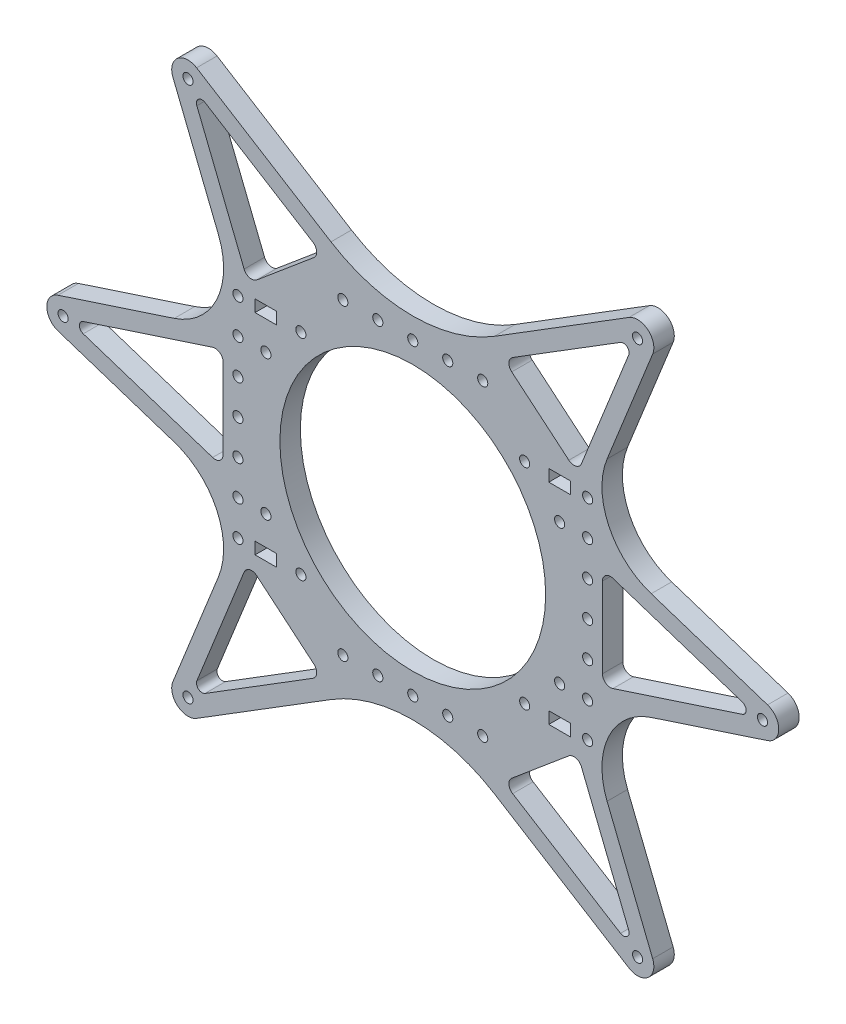
from build123d import *

# Parameters (mm, degrees)
SKETCH1_R           = 1.450000006
SKETCH1_R_2         = 1.45
SKETCH1_R_3         = 38
SKETCH1_W           = 6.2
SKETCH1_H           = 3.4
BOSS_EXTRUDE1_DEPTH = 5.85


with BuildPart() as part:
    # Sketch1 → Boss-Extrude1 (new body)
    with BuildSketch(Plane.XY):
        with BuildLine():
            Line((587.995290395, 497.753361998), (601.026388312, 465.269666287))
            ThreePointArc((601.026388312, 465.269666287), (600.580353033, 449.003385667), (588.406365105, 438.205939183))
            Line((588.406365105, 438.205939183), (555.146182231, 427.30822221))
            ThreePointArc((555.146182231, 427.30822221), (551.939243509, 422.882775531), (555.146182231, 418.457328853))
            Line((555.146182231, 418.457328853), (588.406366938, 407.55961128))
            ThreePointArc((588.406366938, 407.55961128), (600.58035448, 396.762164902), (601.026389221, 380.495884628))
            Line((601.026389221, 380.495884628), (587.995289899, 348.01218948))
            ThreePointArc((587.995289899, 348.01218948), (589.32399836, 342.710908714), (594.775468563, 342.322944064))
            Line((594.775468563, 342.322944064), (633.210915705, 366.208380082))
            ThreePointArc((633.210915705, 366.208380082), (644.436635852, 371.181514399), (656.596182238, 372.882775531))
            ThreePointArc((656.596182238, 372.882775531), (668.755728624, 371.181514399), (679.981448771, 366.208380082))
            Line((679.981448771, 366.208380082), (718.416895913, 342.322944064))
            ThreePointArc((718.416895913, 342.322944064), (723.868366115, 342.710908714), (725.197074576, 348.01218948))
            Line((725.197074576, 348.01218948), (712.165975255, 380.495884628))
            ThreePointArc((712.165975255, 380.495884628), (712.612009996, 396.762164902), (724.785997538, 407.559611279))
            Line((724.785997538, 407.559611279), (758.046182244, 418.457328853))
            ThreePointArc((758.046182244, 418.457328853), (761.253120966, 422.882775531), (758.046182244, 427.30822221))
            Line((758.046182244, 427.30822221), (724.785999371, 438.205939183))
            ThreePointArc((724.785999371, 438.205939183), (712.612011443, 449.003385667), (712.165976164, 465.269666287))
            Line((712.165976164, 465.269666287), (725.197074081, 497.753361998))
            ThreePointArc((725.197074081, 497.753361998), (723.86836572, 503.054641878), (718.416896408, 503.442606583))
            Line((718.416896408, 503.442606583), (679.981448771, 479.557172561))
            ThreePointArc((679.981448771, 479.557172561), (668.755728555, 474.584038083), (656.596182238, 472.882775531))
            ThreePointArc((656.596182238, 472.882775531), (644.436635921, 474.584038083), (633.210915705, 479.557172561))
            Line((633.210915705, 479.557172561), (594.775468067, 503.442606583))
            ThreePointArc((594.775468067, 503.442606583), (589.323998755, 503.054641878), (587.995290395, 497.753361998))
        make_face()
        with Locations((592.317421269, 499.487219843)):
            Circle(SKETCH1_R, mode=Mode.SUBTRACT)
        with Locations(Location((706.596182238, 432.882775531, 0), (0, 0, 180))):
            Circle(SKETCH1_R_2, mode=Mode.SUBTRACT)
        with Locations(Location((706.596182238, 442.882775531, 0), (0, 0, 180))):
            Circle(SKETCH1_R_2, mode=Mode.SUBTRACT)
        with Locations(Location((706.596182238, 452.882775531, 0), (0, 0, 180))):
            Circle(SKETCH1_R_2, mode=Mode.SUBTRACT)
        with Locations((706.596182238, 392.882775531)):
            Circle(SKETCH1_R_2, mode=Mode.SUBTRACT)
        with Locations((556.596182238, 422.882775531)):
            Circle(SKETCH1_R, mode=Mode.SUBTRACT)
        with Locations(Location((646.596182238, 378.882775531, 0), (0, 0, 180))):
            Circle(SKETCH1_R_2, mode=Mode.SUBTRACT)
        with Locations((656.596182238, 422.882775531)):
            Circle(SKETCH1_R_3, mode=Mode.SUBTRACT)
        with Locations(Location((636.596182238, 378.882775531, 0), (0, 0, 180))):
            Circle(SKETCH1_R_2, mode=Mode.SUBTRACT)
        with Locations((706.596182238, 402.882775531)):
            Circle(SKETCH1_R_2, mode=Mode.SUBTRACT)
        with Locations((656.596182238, 466.882775531)):
            Circle(SKETCH1_R_2, mode=Mode.SUBTRACT)
        with Locations((592.317421269, 346.278331219)):
            Circle(SKETCH1_R, mode=Mode.SUBTRACT)
        with Locations((706.596182238, 412.882775531)):
            Circle(SKETCH1_R_2, mode=Mode.SUBTRACT)
        with Locations(Location((656.596182238, 378.882775531, 0), (0, 0, 180))):
            Circle(SKETCH1_R_2, mode=Mode.SUBTRACT)
        with Locations(Location((698.596182238, 442.882775531, 0), (0, 0, 180))):
            Circle(SKETCH1_R_2, mode=Mode.SUBTRACT)
        with Locations((698.596182238, 402.882775531)):
            Circle(SKETCH1_R_2, mode=Mode.SUBTRACT)
        with Locations((646.596182238, 466.882775531)):
            Circle(SKETCH1_R_2, mode=Mode.SUBTRACT)
        with Locations((636.596182238, 466.882775531)):
            Circle(SKETCH1_R_2, mode=Mode.SUBTRACT)
        with Locations(Location((676.596182238, 466.882775531, 0), (0, 0, 180))):
            Circle(SKETCH1_R_2, mode=Mode.SUBTRACT)
        with Locations(Location((666.596182238, 466.882775531, 0), (0, 0, 180))):
            Circle(SKETCH1_R_2, mode=Mode.SUBTRACT)
        with Locations(Location((706.596182238, 422.882775531, 0), (0, 0, 180))):
            Circle(SKETCH1_R_2, mode=Mode.SUBTRACT)
        with Locations(Location((688.596182238, 452.882775531, 0), (0, 0, 180))):
            Circle(SKETCH1_R_2, mode=Mode.SUBTRACT)
        with Locations((688.596182238, 392.882775531)):
            Circle(SKETCH1_R_2, mode=Mode.SUBTRACT)
        with Locations(Location((624.596182238, 392.882775531, 0), (0, 0, 180))):
            Circle(SKETCH1_R_2, mode=Mode.SUBTRACT)
        with Locations(Location((720.874943207, 346.278331219, 0), (0, 0, 180))):
            Circle(SKETCH1_R, mode=Mode.SUBTRACT)
        with Locations((676.596182238, 378.882775531)):
            Circle(SKETCH1_R_2, mode=Mode.SUBTRACT)
        with Locations((666.596182238, 378.882775531)):
            Circle(SKETCH1_R_2, mode=Mode.SUBTRACT)
        with Locations(Location((756.596182238, 422.882775531, 0), (0, 0, 180))):
            Circle(SKETCH1_R, mode=Mode.SUBTRACT)
        with Locations((624.596182238, 452.882775531)):
            Circle(SKETCH1_R_2, mode=Mode.SUBTRACT)
        with Locations((606.596182238, 422.882775531)):
            Circle(SKETCH1_R_2, mode=Mode.SUBTRACT)
        with Locations(Location((720.874943207, 499.487219843, 0), (0, 0, 180))):
            Circle(SKETCH1_R, mode=Mode.SUBTRACT)
        with Locations(Location((614.596182238, 402.882775531, 0), (0, 0, 180))):
            Circle(SKETCH1_R_2, mode=Mode.SUBTRACT)
        with Locations((614.596182238, 442.882775531)):
            Circle(SKETCH1_R_2, mode=Mode.SUBTRACT)
        with Locations(Location((606.596182238, 412.882775531, 0), (0, 0, 180))):
            Circle(SKETCH1_R_2, mode=Mode.SUBTRACT)
        with Locations(Location((606.596182238, 402.882775531, 0), (0, 0, 180))):
            Circle(SKETCH1_R_2, mode=Mode.SUBTRACT)
        with Locations(Location((606.596182238, 392.882775531, 0), (0, 0, 180))):
            Circle(SKETCH1_R_2, mode=Mode.SUBTRACT)
        with Locations((606.596182238, 452.882775531)):
            Circle(SKETCH1_R_2, mode=Mode.SUBTRACT)
        with Locations((606.596182238, 442.882775531)):
            Circle(SKETCH1_R_2, mode=Mode.SUBTRACT)
        with Locations((606.596182238, 432.882775531)):
            Circle(SKETCH1_R_2, mode=Mode.SUBTRACT)
        with BuildLine():
            Line((594.852213644, 494.089955534), (608.369257372, 460.394902501))
            ThreePointArc((608.369257372, 460.394902501), (609.936297881, 459.027594122), (611.962982661, 459.494174197))
            Line((611.962982661, 459.494174197), (628.291466753, 473.195399177))
            ThreePointArc((628.291466753, 473.195399177), (629.102888547, 475.11027328), (628.028466383, 476.890937531))
            Line((628.028466383, 476.890937531), (597.192526929, 496.053711548))
            ThreePointArc((597.192526929, 496.053711548), (595.310843783, 495.919797808), (594.852213644, 494.089955534))
        make_face(mode=Mode.SUBTRACT)
        with Locations((698.596182238, 392.882775531)):
            Rectangle(SKETCH1_W, SKETCH1_H, mode=Mode.SUBTRACT)
        with BuildLine():
            Line((562.360059701, 421.35524452), (599.360059701, 409.232174436))
            ThreePointArc((599.360059701, 409.232174436), (601.41475291, 409.553708225), (602.360059701, 411.406150729))
            Line((602.360059701, 411.406150729), (602.360059701, 434.359400333))
            ThreePointArc((602.360059701, 434.359400333), (601.41475291, 436.211842837), (599.360059701, 436.533376627))
            Line((599.360059701, 436.533376627), (562.360059701, 424.410306542))
            ThreePointArc((562.360059701, 424.410306542), (561.253120966, 422.882775531), (562.360059701, 421.35524452))
        make_face(mode=Mode.SUBTRACT)
        with BuildLine():
            Line((594.85221424, 351.675595364), (608.369259134, 385.370647084))
            ThreePointArc((608.369259134, 385.370647084), (609.936299703, 386.737955426), (611.962984497, 386.271375324))
            Line((611.962984497, 386.271375324), (628.291464916, 372.570153427))
            ThreePointArc((628.291464916, 372.570153427), (629.102886739, 370.655279313), (628.028464622, 368.874615009))
            Line((628.028464622, 368.874615009), (597.192526664, 349.711840073))
            ThreePointArc((597.192526664, 349.711840073), (595.310844178, 349.845753725), (594.85221424, 351.675595364))
        make_face(mode=Mode.SUBTRACT)
        with Locations((614.596182238, 452.882775531)):
            Rectangle(SKETCH1_W, SKETCH1_H, mode=Mode.SUBTRACT)
        with Locations((698.596182238, 452.882775531)):
            Rectangle(SKETCH1_W, SKETCH1_H, mode=Mode.SUBTRACT)
        with BuildLine():
            Line((715.999837812, 349.711840073), (685.163899854, 368.874615009))
            ThreePointArc((685.163899854, 368.874615009), (684.089477737, 370.655279313), (684.900899559, 372.570153427))
            Line((684.900899559, 372.570153427), (701.229379978, 386.271375324))
            ThreePointArc((701.229379978, 386.271375324), (703.256064773, 386.737955426), (704.823105342, 385.370647084))
            Line((704.823105342, 385.370647084), (718.340150235, 351.675595364))
            ThreePointArc((718.340150235, 351.675595364), (717.881520298, 349.845753725), (715.999837812, 349.711840073))
        make_face(mode=Mode.SUBTRACT)
        with BuildLine():
            Line((750.832304774, 424.410306542), (713.832304774, 436.533376627))
            ThreePointArc((713.832304774, 436.533376627), (711.777611566, 436.211842837), (710.832304774, 434.359400333))
            Line((710.832304774, 434.359400333), (710.832304774, 411.406150729))
            ThreePointArc((710.832304774, 411.406150729), (711.777611565, 409.553708225), (713.832304774, 409.232174436))
            Line((713.832304774, 409.232174436), (750.832304774, 421.35524452))
            ThreePointArc((750.832304774, 421.35524452), (751.939243509, 422.882775531), (750.832304774, 424.410306542))
        make_face(mode=Mode.SUBTRACT)
        with BuildLine():
            Line((684.900897722, 473.195399177), (701.229381815, 459.494174197))
            ThreePointArc((701.229381815, 459.494174197), (703.256066594, 459.027594122), (704.823107103, 460.394902501))
            Line((704.823107103, 460.394902501), (718.340150832, 494.089955534))
            ThreePointArc((718.340150832, 494.089955534), (717.881520693, 495.919797808), (715.999837547, 496.053711548))
            Line((715.999837547, 496.053711548), (685.163898093, 476.890937531))
            ThreePointArc((685.163898093, 476.890937531), (684.089475929, 475.11027328), (684.900897722, 473.195399177))
        make_face(mode=Mode.SUBTRACT)
        with Locations((614.596182238, 392.882775531)):
            Rectangle(SKETCH1_W, SKETCH1_H, mode=Mode.SUBTRACT)
    extrude(amount=BOSS_EXTRUDE1_DEPTH)


solid = part.part
